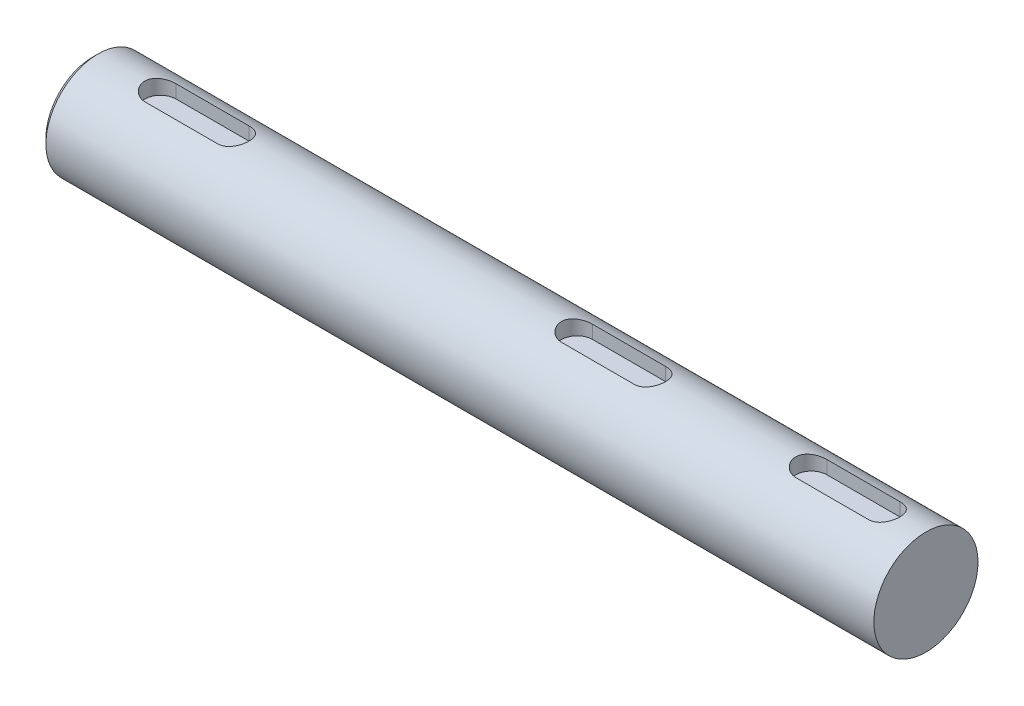
from build123d import *

# Parameters (mm, degrees)
SKETCH_1_R             = 10
EXTRUDE_1_DEPTH        = 200
CUT_EXTRUDE_1_DEPTH    = 3
CHAMFER_1_SIZE         = 1
CHAMFER_2_SIZE         = 1
PATTERN_LINEAR_1_COUNT = 3
PATTERN_LINEAR_1_PITCH = 80
CUT_EXTRUDE_START      = -40
SKETCH_4_R             = 10
CUT_EXTRUDE_2_DEPTH    = 40
PATTERN_LINEAR_3_COUNT = 2
PATTERN_LINEAR_3_PITCH = 125


with BuildPart() as part:
    # 草图1 → 凸台-拉伸1 (new body)
    with BuildSketch(Plane(origin=(0, 0, 0), x_dir=(0, 0, -1), z_dir=(1, 0, 0))):
        Circle(SKETCH_1_R)
    extrude(amount=EXTRUDE_1_DEPTH)

    # 草图2 → 切除-拉伸1 (cut)
    with BuildSketch(Plane(origin=(0, 10, 0), x_dir=(1, 0, 0), z_dir=(0, 1, 0))):
        with BuildLine():
            Line((13, 3), (27, 3))
            ThreePointArc((27, 3), (30, 0), (27, -3))
            Line((27, -3), (13, -3))
            ThreePointArc((13, -3), (10, 0), (13, 3))
        make_face()
    cut_extrude_1 = extrude(amount=-CUT_EXTRUDE_1_DEPTH, mode=Mode.SUBTRACT)

    # 倒角1
    chamfer_1_edges = [part.edges().sort_by_distance(p)[0] for p in [
        (0, 0, 10),
    ]]
    chamfer(chamfer_1_edges, length=CHAMFER_1_SIZE)

    # 倒角2
    chamfer_2_edges = [part.edges().sort_by_distance(p)[0] for p in [
        (200, 0, 10),
    ]]
    chamfer(chamfer_2_edges, length=CHAMFER_2_SIZE)

    # 阵列(线性)1: 切除-拉伸1 ×3
    with Locations(*[(i * PATTERN_LINEAR_1_PITCH, 0, 0) for i in range(1, PATTERN_LINEAR_1_COUNT)]):
        add(cut_extrude_1, mode=Mode.SUBTRACT)

    # 草图4 → 切除-拉伸2 (cut)
    with BuildSketch(Plane(origin=(200, 0, 0), x_dir=(0, 0, -1), z_dir=(1, 0, 0)).offset(CUT_EXTRUDE_START)):
        Circle(SKETCH_4_R)
    extrude(amount=CUT_EXTRUDE_2_DEPTH, mode=Mode.SUBTRACT)

    # 阵列(线性)3: 切除-拉伸1 ×2
    with Locations(*[(i * PATTERN_LINEAR_3_PITCH, 0, 0) for i in range(1, PATTERN_LINEAR_3_COUNT)]):
        add(cut_extrude_1, mode=Mode.SUBTRACT)


solid = part.part
